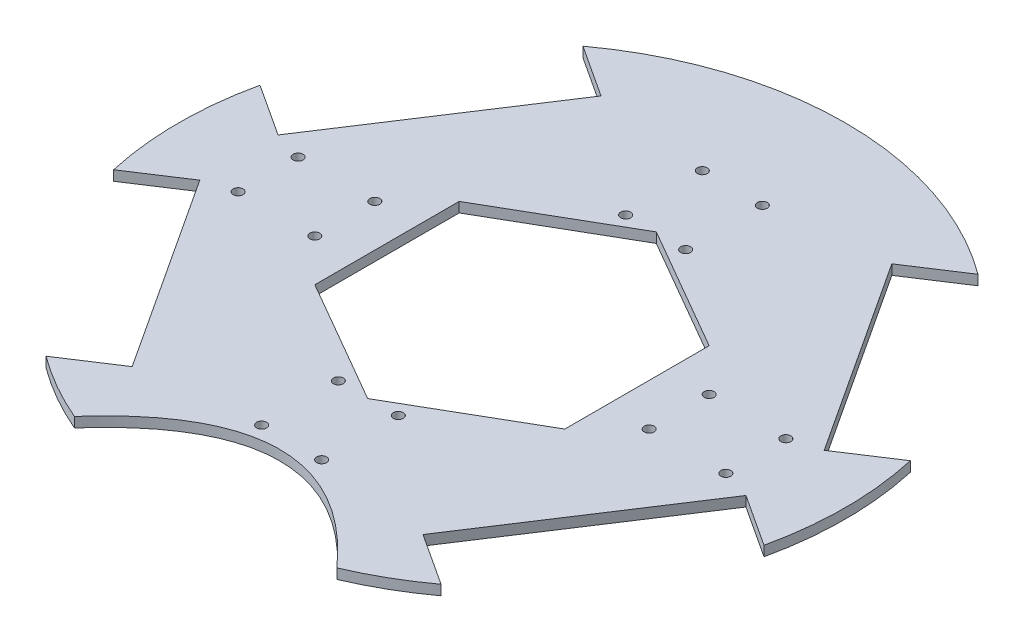
from build123d import *

# Parameters (mm, degrees)
BOSS_EXTRUDE1_DEPTH = 3
CUT_EXTRUDE1_START  = -3
CUT_EXTRUDE1_DEPTH  = 3
CUT_EXTRUDE2_DEPTH  = 3
SKETCH5_R           = 1.5
CUT_EXTRUDE4_DEPTH  = 3


with BuildPart() as part:
    # Sketch2 → Boss-Extrude1 (new body)
    with BuildSketch(Plane(origin=(0, 0, 0), x_dir=(1, 0, 0), z_dir=(0, 1, 0))):
        with BuildLine():
            ThreePointArc((100, 0), (-55.065067857, 83.473578466), (-39.356766037, -91.92956525))
            add(Edge.make_bspline(
                [(-39.356766037, -91.92956525), (-19.678383019, -69.689240506), (0, -69.689240506)],
                knots=[0, 0, 0, 0.5, 0.5, 0.5], degree=2))
            add(Edge.make_bspline(
                [(0, -69.689240506), (19.678383019, -69.689240506), (39.356766037, -91.92956525)],
                knots=[0.5, 0.5, 0.5, 1, 1, 1], degree=2))
            ThreePointArc((39.356766037, -91.92956525), (83.473578466, -55.065067857), (100, 0))
        make_face()
    extrude(amount=BOSS_EXTRUDE1_DEPTH)

    # Sketch3 → Cut-Extrude1 (cut)
    with BuildSketch(Plane(origin=(0, 3, 0), x_dir=(1, 0, 0), z_dir=(0, 1, 0)).offset(CUT_EXTRUDE1_START)):
        with BuildLine():
            ThreePointArc((-83.703770268, 54.714521317), (-92.099700567, 38.95696543), (-97.559564128, 21.957491822))
            Line((-97.559564128, 21.957491822), (-81.927910162, 11.739571394))
            Line((-81.927910162, 11.739571394), (-43.62774524, 70.332210581))
            Line((-43.62774524, 70.332210581), (-59.259399207, 80.55013101))
            ThreePointArc((-59.259399207, 80.55013101), (-72.639428953, 68.727820869), (-83.703770268, 54.714521317))
        make_face()
        with BuildLine():
            ThreePointArc((83.703770268, 54.714521317), (72.639428953, 68.727820869), (59.259399207, 80.55013101))
            Line((59.259399207, 80.55013101), (43.62774524, 70.332210581))
            Line((43.62774524, 70.332210581), (81.927910162, 11.739571394))
            Line((81.927910162, 11.739571394), (97.559564128, 21.957491822))
            ThreePointArc((97.559564128, 21.957491822), (92.099700567, 38.95696543), (83.703770268, 54.714521317))
        make_face()
        with BuildLine():
            ThreePointArc((83.703770268, -54.714521317), (92.099700567, -38.95696543), (97.559564128, -21.957491822))
            Line((97.559564128, -21.957491822), (81.927910162, -11.739571394))
            Line((81.927910162, -11.739571394), (43.62774524, -70.332210581))
            Line((43.62774524, -70.332210581), (59.259399207, -80.55013101))
            ThreePointArc((59.259399207, -80.55013101), (72.639428953, -68.727820869), (83.703770268, -54.714521317))
        make_face()
        with BuildLine():
            ThreePointArc((-97.559564128, -21.957491822), (-92.099700567, -38.95696543), (-83.703770268, -54.714521317))
            ThreePointArc((-83.703770268, -54.714521317), (-72.639428953, -68.727820869), (-59.259399207, -80.55013101))
            Line((-59.259399207, -80.55013101), (-43.62774524, -70.332210581))
            Line((-43.62774524, -70.332210581), (-81.927910162, -11.739571394))
            Line((-81.927910162, -11.739571394), (-97.559564128, -21.957491822))
        make_face()
    extrude(amount=CUT_EXTRUDE1_DEPTH, mode=Mode.SUBTRACT)

    # Sketch4 → Cut-Extrude2 (cut)
    with BuildSketch(Plane(origin=(0, 3, 0), x_dir=(1, 0, 0), z_dir=(0, 1, 0))):
        Polygon((0, 43.301270189), (-37.5, 21.650635095), (-37.5, -21.650635095), (0, -43.301270189), (37.5, -21.650635095), (37.5, 21.650635095), align=None)
    extrude(amount=-CUT_EXTRUDE2_DEPTH, mode=Mode.SUBTRACT)

    # Sketch5 → Cut-Extrude4 (cut)
    with BuildSketch(Plane(origin=(0, 3, 0), x_dir=(1, 0, 0), z_dir=(0, 1, 0))):
        with Locations(Location((-73.162499204, 9, 0), (0, 0, 270))):
            Circle(SKETCH5_R)
        with Locations(Location((-73.162499204, -9, 0), (0, 0, 270))):
            Circle(SKETCH5_R)
        with Locations(Location((-50.162499204, -9, 0), (0, 0, 270))):
            Circle(SKETCH5_R)
        with Locations(Location((-50.162499204, 9, 0), (0, 0, 270))):
            Circle(SKETCH5_R)
        with Locations(Location((9, 66.105117767, 0), (0, 0, 270))):
            Circle(SKETCH5_R)
        with Locations(Location((-9, 66.105117767, 0), (0, 0, 270))):
            Circle(SKETCH5_R)
        with Locations(Location((-9, 43.105117767, 0), (0, 0, 270))):
            Circle(SKETCH5_R)
        with Locations(Location((9, 43.105117767, 0), (0, 0, 270))):
            Circle(SKETCH5_R)
        with Locations(Location((73.16, 9, 0), (0, 0, 270))):
            Circle(SKETCH5_R)
        with Locations(Location((50.16, -9, 0), (0, 0, 270))):
            Circle(SKETCH5_R)
        with Locations(Location((9, -43.105117767, 0), (0, 0, 270))):
            Circle(SKETCH5_R)
        with Locations(Location((-9, -43.105117767, 0), (0, 0, 270))):
            Circle(SKETCH5_R)
        with Locations(Location((-9, -66.105117767, 0), (0, 0, 270))):
            Circle(SKETCH5_R)
        with Locations(Location((9, -66.105117767, 0), (0, 0, 270))):
            Circle(SKETCH5_R)
        with Locations(Location((50.16, 9, 0), (0, 0, 270))):
            Circle(SKETCH5_R)
        with Locations(Location((73.16, -9, 0), (0, 0, 270))):
            Circle(SKETCH5_R)
    extrude(amount=-CUT_EXTRUDE4_DEPTH, mode=Mode.SUBTRACT)


solid = part.part
